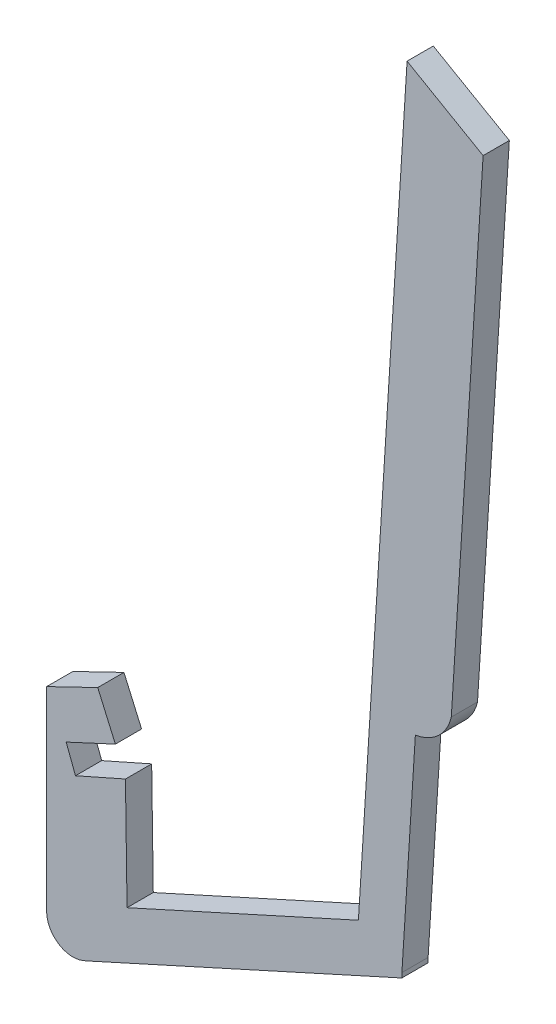
from build123d import *

# Parameters (mm, degrees)
BASE_EXTRUDE_DEPTH = 3


with BuildPart() as part:
    # Sketch1 → Base-Extrude (new body)
    with BuildSketch(Plane.XY):
        with BuildLine():
            Line((827.973978263, -43.245786047), (829.514372586, -18.937919224))
            ThreePointArc((829.514372586, -18.937919224), (832.162066859, -17.653066314), (833.626640717, -15.100390193))
            Line((833.626640717, -15.100390193), (837.267672807, 42.356146641))
            Line((837.267672807, 42.356146641), (828.567150472, 47.366870762))
            Line((828.567150472, 47.366870762), (822.996025927, -40.547081848))
            Line((822.996025927, -40.547081848), (796.525541864, -52.540147354))
            Line((796.525541864, -52.540147354), (796.34247294, -39.8809937))
            Line((796.34247294, -39.8809937), (790.624612073, -42.415731004))
            Line((790.624612073, -42.415731004), (789.560278608, -39.610879088))
            Line((789.560278608, -39.610879088), (795.188053447, -37.002397586))
            Line((795.188053447, -37.002397586), (793.171716746, -32.401991353))
            Line((793.171716746, -32.401991353), (787.326904418, -35.230416068))
            Line((787.326904418, -35.230416068), (787.326904418, -57.526741279))
            ThreePointArc((787.326904418, -57.526741279), (788.61109588, -59.98763564), (791.364238458, -60.341690318))
            ThreePointArc((791.364238458, -60.341690318), (791.701286321, -60.210514776), (792.033370234, -60.067236869))
            Line((792.033370234, -60.067236869), (827.968278958, -43.7860947))
            ThreePointArc((827.968278958, -43.7860947), (827.974778648, -43.515978875), (827.973978263, -43.245786047))
        make_face()
    extrude(amount=BASE_EXTRUDE_DEPTH)


solid = part.part
